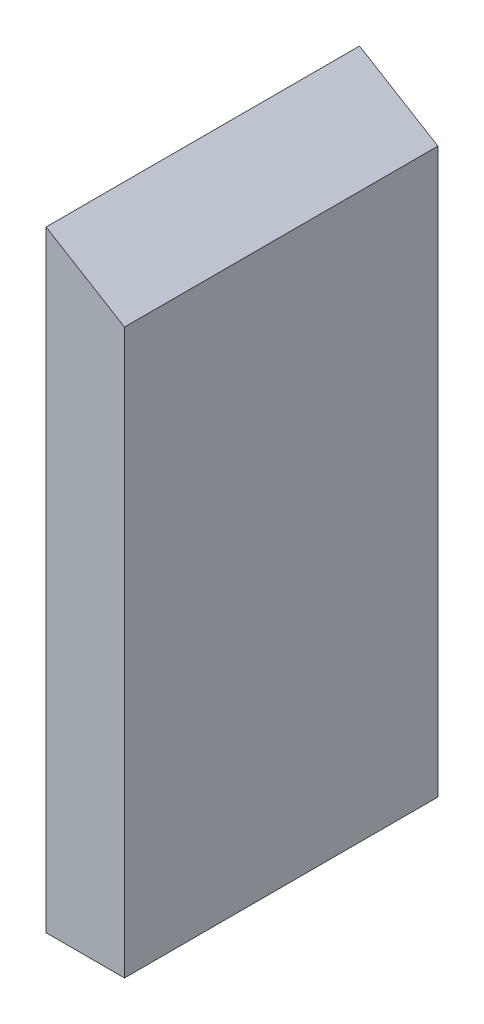
from build123d import *

# Parameters (mm, degrees)
BOSS_EXTRUDE1_DEPTH = 40


with BuildPart() as part:
    # Sketch1 → Boss-Extrude1 (new body)
    with BuildSketch(Plane.XY):
        Polygon((0, 0), (0, 78), (10, 71.936626029), (10, 0), align=None)
    extrude(amount=BOSS_EXTRUDE1_DEPTH)


solid = part.part
